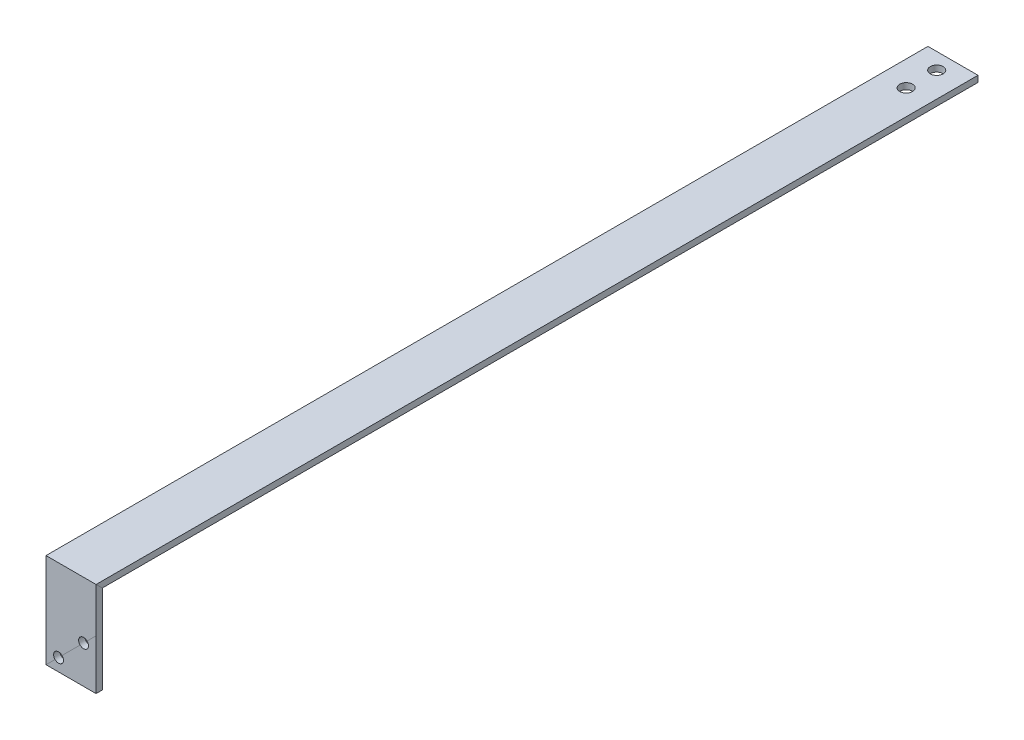
from build123d import *

# Parameters (mm, degrees)
CROQUIS1_W            = 50.8
CROQUIS1_H            = 6.31
CROQUIS2_R            = 6.5
CORTAR_EXTRUIR1_DEPTH = 10
CROQUIS3_R            = 6.5
CORTAR_EXTRUIR2_DEPTH = 10
CROQUIS4_W            = 59.2
CROQUIS4_H            = 50.8
CORTAR_EXTRUIR3_DEPTH = 10
CROQUIS5_R            = 5
CORTAR_EXTRUIR4_DEPTH = 10


with BuildPart() as part:
    # Barrer1: sweep along a curve in space
    with BuildLine() as barrer1_path:
        Line((0, 0, 0), (0, 0, 891.73))
        Line((0, 0, 891.73), (0, -67.38, 891.73))
        Line((0, -67.38, 891.73), (84.6, -67.38, 891.73))
    # Croquis1 → Barrer1 (sweep)
    with BuildSketch(Plane.XY):
        Rectangle(CROQUIS1_W, CROQUIS1_H)
    sweep(path=barrer1_path.line, transition=Transition.RIGHT)

    # Croquis2 → Cortar-Extruir1 (cut)
    with BuildSketch(Plane(origin=(0, 3.155, 0), x_dir=(1, 0, 0), z_dir=(0, 1, 0))):
        with Locations(Location((0, -16.5, 0), (0, 0, 270))):
            Circle(CROQUIS2_R)
        with Locations(Location((0, -47.5, 0), (0, 0, 270))):
            Circle(CROQUIS2_R)
    extrude(amount=-CORTAR_EXTRUIR1_DEPTH, mode=Mode.SUBTRACT)

    # Croquis3 → Cortar-Extruir2 (cut)
    with BuildSketch(Plane(origin=(0, 0, 888.575), x_dir=(-1, 0, 0), z_dir=(0, 0, -1))):
        with Locations((-60, -67.38)):
            Circle(CROQUIS3_R)
    extrude(amount=-CORTAR_EXTRUIR2_DEPTH, mode=Mode.SUBTRACT)

    # Croquis4 → Cortar-Extruir3 (cut)
    with BuildSketch(Plane.XY.offset(894.885)):
        with Locations((55, -67.38)):
            Rectangle(CROQUIS4_W, CROQUIS4_H)
    extrude(amount=-CORTAR_EXTRUIR3_DEPTH, mode=Mode.SUBTRACT)

    # Croquis5 → Cortar-Extruir4 (cut)
    with BuildSketch(Plane(origin=(0, 0, 888.575), x_dir=(-1, 0, 0), z_dir=(0, 0, -1))):
        with Locations(Location((-12.7, -54.68, 0), (0, 0, 315))):
            Circle(CROQUIS5_R)
        with Locations(Location((12.7, -80.08, 0), (0, 0, 315))):
            Circle(CROQUIS5_R)
    extrude(amount=-CORTAR_EXTRUIR4_DEPTH, mode=Mode.SUBTRACT)


solid = part.part
